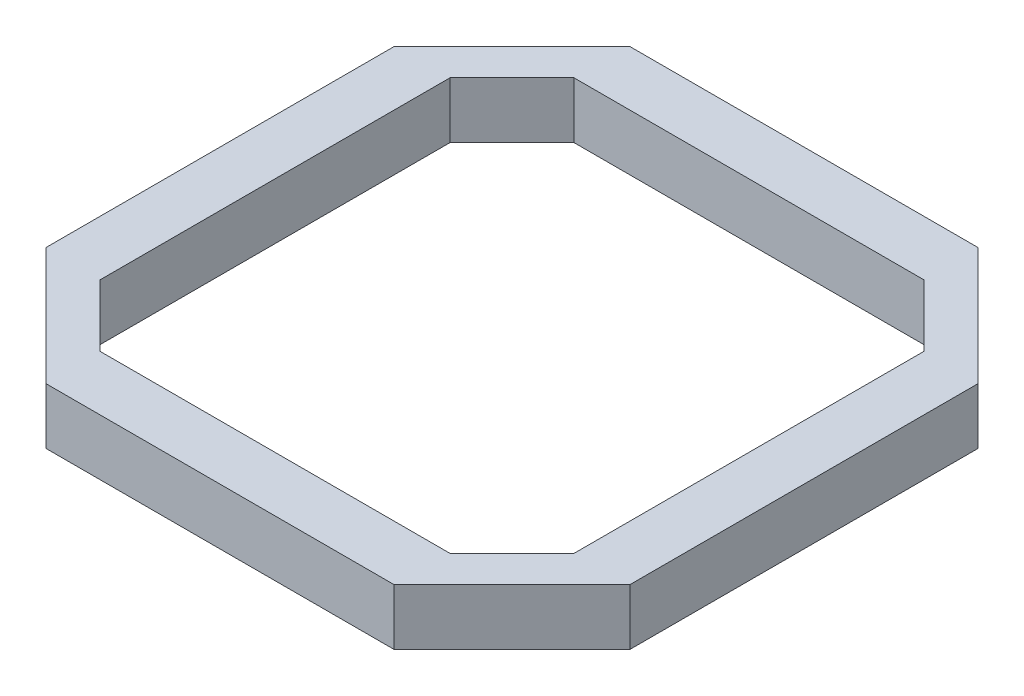
from build123d import *

# Parameters (mm, degrees)
BOSS_EXTRUDE1_DEPTH = 5
CUT_EXTRUDE1_DEPTH  = 5


with BuildPart() as part:
    # Sketch2 → Boss-Extrude1 (new body)
    with BuildSketch(Plane(origin=(0, 0, 0), x_dir=(1, 0, 0), z_dir=(0, 1, 0))):
        Polygon((-15.5, -26), (15.5, -26), (26, -15.5), (26, 15.5), (15.5, 26), (-15.5, 26), (-26, 15.5), (-26, -15.5), align=None)
    extrude(amount=BOSS_EXTRUDE1_DEPTH)

    # Sketch3 → Cut-Extrude1 (cut)
    with BuildSketch(Plane(origin=(0, 5, 0), x_dir=(1, 0, 0), z_dir=(0, 1, 0))):
        Polygon((-21.1, -15.6), (-21.1, 15.6), (-15.6, 21.1), (15.6, 21.1), (21.1, 15.6), (21.1, -15.6), (15.6, -21.1), (-15.6, -21.1), align=None)
    extrude(amount=-CUT_EXTRUDE1_DEPTH, mode=Mode.SUBTRACT)


solid = part.part
